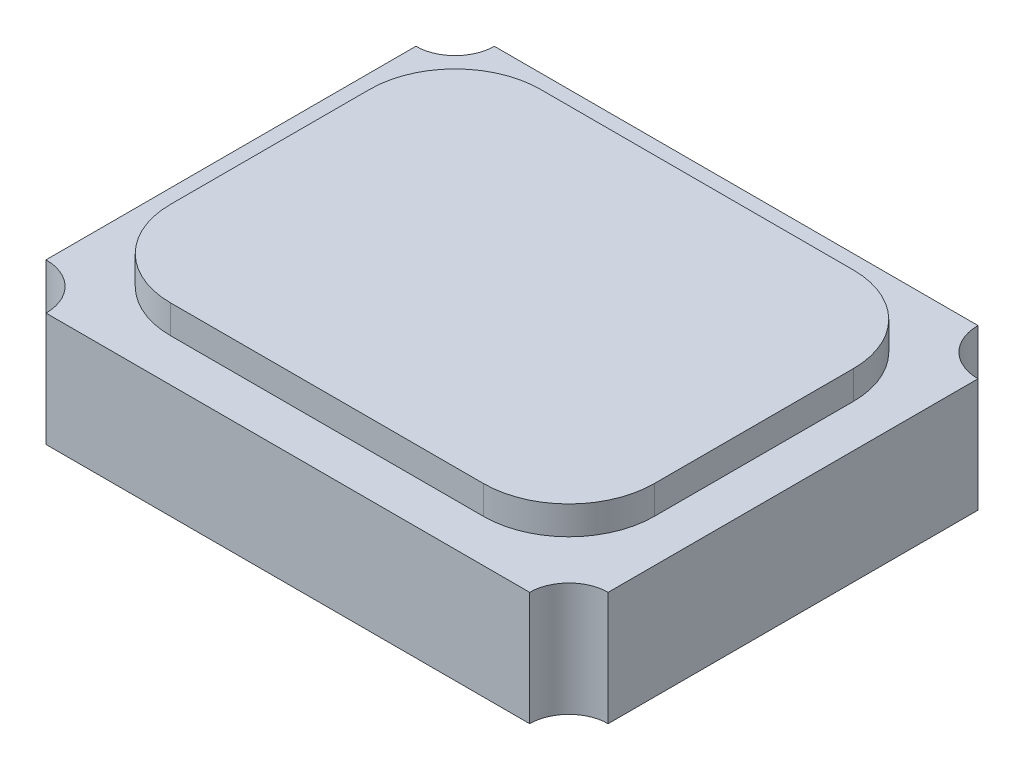
from build123d import *

# Parameters (mm, degrees)
SKETCH1_W           = 2
SKETCH1_H           = 1.6
BOSS_EXTRUDE1_DEPTH = 0.5
SKETCH3_W           = 2
SKETCH3_H           = 1.6
CUT_EXTRUDE1_DEPTH  = 0.1
CUT_EXTRUDE2_DEPTH  = 0.5


with BuildPart() as part:
    # Sketch1 → Boss-Extrude1 (new body)
    with BuildSketch(Plane(origin=(0, 0, 0), x_dir=(1, 0, 0), z_dir=(0, 1, 0))):
        with Locations((1, 0.8)):
            Rectangle(SKETCH1_W, SKETCH1_H)
    extrude(amount=BOSS_EXTRUDE1_DEPTH)

    # Sketch3 → Cut-Extrude1 (cut)
    with BuildSketch(Plane(origin=(0, 0.5, 0), x_dir=(1, 0, 0), z_dir=(0, 1, 0))):
        with Locations((1, 0.8)):
            Rectangle(SKETCH3_W, SKETCH3_H)
        with BuildLine():
            Line((0.45, 1.45), (1.55, 1.45))
            ThreePointArc((1.55, 1.45), (1.762132034, 1.362132034), (1.85, 1.15))
            Line((1.85, 1.15), (1.85, 0.45))
            ThreePointArc((1.85, 0.45), (1.762132034, 0.237867966), (1.55, 0.15))
            Line((1.55, 0.15), (0.45, 0.15))
            ThreePointArc((0.45, 0.15), (0.237867966, 0.237867966), (0.15, 0.45))
            Line((0.15, 0.45), (0.15, 1.15))
            ThreePointArc((0.15, 1.15), (0.237867966, 1.362132034), (0.45, 1.45))
        make_face(mode=Mode.SUBTRACT)
    extrude(amount=-CUT_EXTRUDE1_DEPTH, mode=Mode.SUBTRACT)

    # Sketch2 → Cut-Extrude2 (cut)
    with BuildSketch(Plane(origin=(0, 0.5, 0), x_dir=(1, 0, 0), z_dir=(0, 1, 0))):
        with BuildLine():
            ThreePointArc((0, 1.462118963), (0.097496616, 1.502503384), (0.137881037, 1.6))
            Line((0.137881037, 1.6), (0, 1.6))
            Line((0, 1.6), (0, 1.462118963))
        make_face()
        with BuildLine():
            Line((2, 1.6), (1.837881037, 1.6))
            ThreePointArc((1.837881037, 1.6), (1.885364582, 1.485364582), (2, 1.437881037))
            Line((2, 1.437881037), (2, 1.6))
        make_face()
        with BuildLine():
            ThreePointArc((0.162118963, 0), (0.114635418, 0.114635418), (0, 0.162118963))
            Line((0, 0.162118963), (0, 0))
            Line((0, 0), (0.162118963, 0))
        make_face()
        with BuildLine():
            Line((2, 0), (2, 0.137881037))
            ThreePointArc((2, 0.137881037), (1.902503384, 0.097496616), (1.862118963, 0))
            Line((1.862118963, 0), (2, 0))
        make_face()
    extrude(amount=-CUT_EXTRUDE2_DEPTH, mode=Mode.SUBTRACT)


solid = part.part
